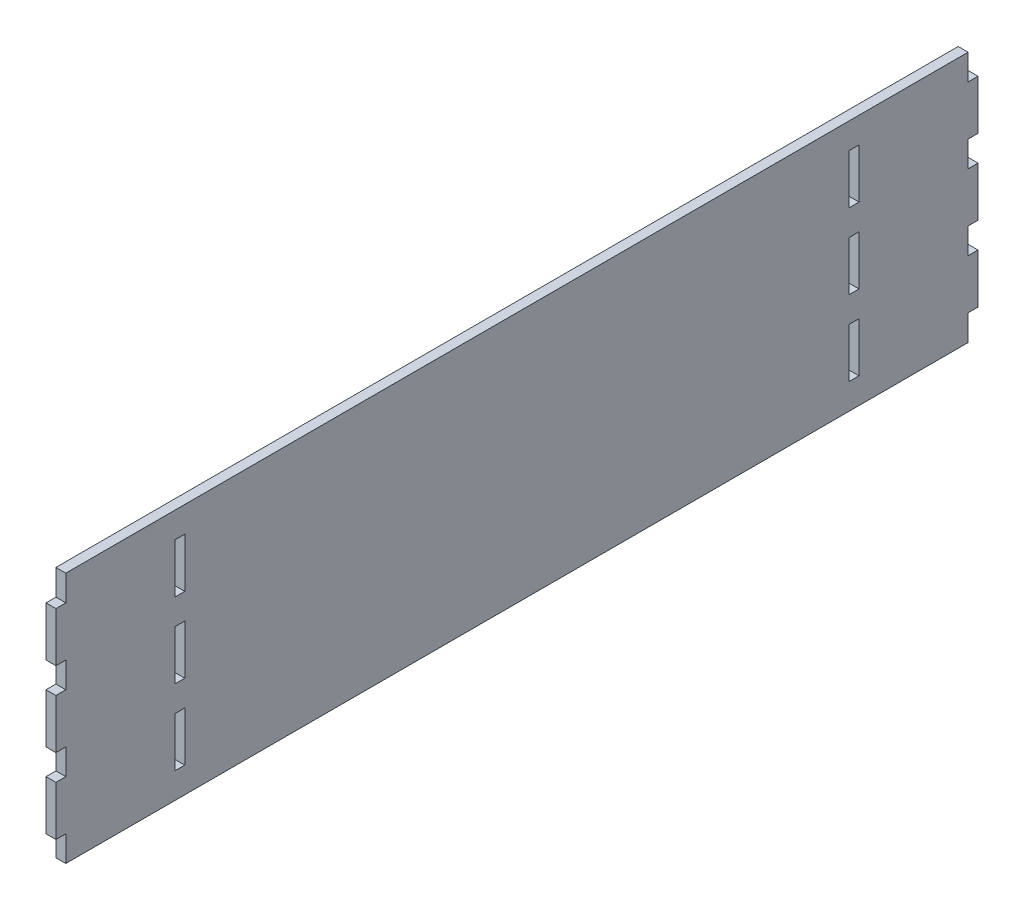
from build123d import *

# Parameters (mm, degrees)
SKETCH1_W                 = 279.4
SKETCH1_H                 = 76.2
BOSS_EXTRUDE1_DEPTH       = 3
SKETCH3_W                 = 3
SKETCH3_H                 = 15
SKETCH3_H_2               = 7.8
CUT_EXTRUDE1_DEPTH        = 145.833352512
LPATTERN1_COUNT           = 4
LPATTERN1_PITCH           = 22.8
MIRROR1_COPY_1_SKETCH_W   = 3
MIRROR1_COPY_1_SKETCH_H   = 15
MIRROR1_COPY_1_SKETCH_H_2 = 7.8
MIRROR1_COPY_1_DEPTH      = 145.833352512
MIRROR1_COPY_2_SKETCH_W   = 3
MIRROR1_COPY_2_SKETCH_H   = 15
MIRROR1_COPY_2_SKETCH_H_2 = 7.8
MIRROR1_COPY_2_DEPTH      = 145.833352512
MIRROR1_COPY_3_SKETCH_W   = 3
MIRROR1_COPY_3_SKETCH_H   = 15
MIRROR1_COPY_3_SKETCH_H_2 = 7.8
MIRROR1_COPY_3_DEPTH      = 145.833352512


with BuildPart() as part:
    # Sketch1 → Boss-Extrude1 (new body)
    with BuildSketch(Plane(origin=(0, 0, 0), x_dir=(0, 0, -1), z_dir=(1, 0, 0))):
        Rectangle(SKETCH1_W, SKETCH1_H)
    extrude(amount=-BOSS_EXTRUDE1_DEPTH)

    # Sketch3 → Cut-Extrude1 (cut, through all)
    with BuildSketch(Plane.ZY.offset(3)):
        with Locations((-102.15, 22.8)):
            Rectangle(SKETCH3_W, SKETCH3_H)
        with Locations((-138.2, 34.2)):
            Rectangle(SKETCH3_W, SKETCH3_H_2)
    cut_extrude1 = extrude(amount=-CUT_EXTRUDE1_DEPTH, mode=Mode.SUBTRACT)

    # LPattern1: Cut-Extrude1 ×4
    with Locations(*[(0, -i * LPATTERN1_PITCH, 0) for i in range(1, LPATTERN1_COUNT)]):
        add(cut_extrude1, mode=Mode.SUBTRACT)

    # Mirror1: Cut-Extrude1 across plane
    add(cut_extrude1.mirror(Plane.XY), mode=Mode.SUBTRACT)

    # Mirror1 copy 1 sketch → Mirror1 copy 1 (cut, through all)
    with BuildSketch(Plane(origin=(-3, -22.8, 0), x_dir=(0, 0, -1), z_dir=(-1, 0, 0))):
        with Locations((-102.15, -22.8)):
            Rectangle(MIRROR1_COPY_1_SKETCH_W, MIRROR1_COPY_1_SKETCH_H)
        with Locations((-138.2, -34.2)):
            Rectangle(MIRROR1_COPY_1_SKETCH_W, MIRROR1_COPY_1_SKETCH_H_2)
    extrude(amount=-MIRROR1_COPY_1_DEPTH, mode=Mode.SUBTRACT)

    # Mirror1 copy 2 sketch → Mirror1 copy 2 (cut, through all)
    with BuildSketch(Plane(origin=(-3, -45.6, 0), x_dir=(0, 0, -1), z_dir=(-1, 0, 0))):
        with Locations((-102.15, -22.8)):
            Rectangle(MIRROR1_COPY_2_SKETCH_W, MIRROR1_COPY_2_SKETCH_H)
        with Locations((-138.2, -34.2)):
            Rectangle(MIRROR1_COPY_2_SKETCH_W, MIRROR1_COPY_2_SKETCH_H_2)
    extrude(amount=-MIRROR1_COPY_2_DEPTH, mode=Mode.SUBTRACT)

    # Mirror1 copy 3 sketch → Mirror1 copy 3 (cut, through all)
    with BuildSketch(Plane(origin=(-3, -68.4, 0), x_dir=(0, 0, -1), z_dir=(-1, 0, 0))):
        with Locations((-102.15, -22.8)):
            Rectangle(MIRROR1_COPY_3_SKETCH_W, MIRROR1_COPY_3_SKETCH_H)
        with Locations((-138.2, -34.2)):
            Rectangle(MIRROR1_COPY_3_SKETCH_W, MIRROR1_COPY_3_SKETCH_H_2)
    extrude(amount=-MIRROR1_COPY_3_DEPTH, mode=Mode.SUBTRACT)


solid = part.part
